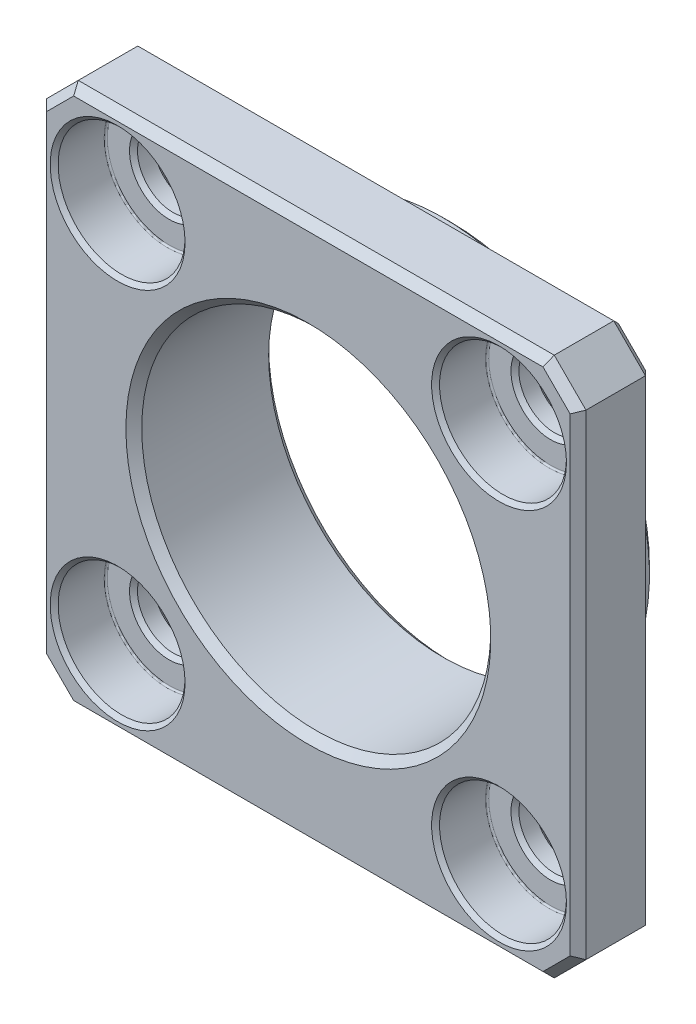
from build123d import *

# Parameters (mm, degrees)
BK_FLANGE_SKETCH_W         = 34
BK_FLANGE_SKETCH_H         = 34
BK_FLANGE_BODY_DEPTH       = 4.75
BK_FLANGE_RADIUS_SKETCH_R  = 13
BK_FLANGE_RADIUS_DEPTH     = 4.25
BK_FLANGE_HOLE_DEPTH       = 26.670995306
BK_FLANGE_HOLE_DEPTH_BACK  = 26.670995306
BK_FLANGE_H_R              = 11
BK_FLANGE_HOLES_AT_2_COUNT = 2
BK_FLANGE_HOLES_AT_2_PITCH = 24.04163056
BK_FLANGE_HOLES_AT_3_COUNT = 2
BK_FLANGE_HOLES_AT_3_PITCH = 34
BK_FLANGE_HOLES_AT_4_COUNT = 2
BK_FLANGE_HOLES_AT_4_PITCH = 24.04163056
BK_CORNER_CHAMFER_SIZE     = 2
PRODUCTION_FILLET_R        = 0.1
AESTHETIC_CHAMFER_SIZE     = 0.5


with BuildPart() as part:
    # BK Flange Sketch → BK Flange Body (new body)
    with BuildSketch(Plane.XY):
        Rectangle(BK_FLANGE_SKETCH_W, BK_FLANGE_SKETCH_H)
    extrude(amount=BK_FLANGE_BODY_DEPTH)

    # BK Flange Radius Sketch → BK Flange Radius (add)
    with BuildSketch(Plane(origin=(0, 0, 0), x_dir=(-1, 0, 0), z_dir=(0, 0, -1))):
        Circle(BK_FLANGE_RADIUS_SKETCH_R)
    extrude(amount=BK_FLANGE_RADIUS_DEPTH)

    # BK Flange H → BK Flange Hole (cut, two sides: drawn at the far end of the back side and taken through both)
    with BuildSketch(Plane(origin=(0, 0, -4.25), x_dir=(-1, 0, 0), z_dir=(0, 0, -1)).offset(-BK_FLANGE_HOLE_DEPTH_BACK)):
        Circle(BK_FLANGE_H_R)
    extrude(amount=BK_FLANGE_HOLE_DEPTH + BK_FLANGE_HOLE_DEPTH_BACK, mode=Mode.SUBTRACT)

    # Sketch2 → BK Flange Holes (revolve, cut)
    with BuildSketch(Plane(origin=(-12.02081528, 12.02081528, 4.75), x_dir=(0, -1, 0), z_dir=(1, 0, 0))):
        Polygon((0, 0), (0, 4.75), (2.5, 4.75), (2.25, 4.5), (2.25, 3.5), (2.5, 3.25), (4, 3.25), (4, 0.25), (4.25, 0), align=None)
    bk_flange_holes = revolve(axis=Axis((-12.02081528, 12.02081528, 11.1), (0, 0, -1)), mode=Mode.SUBTRACT)

    # BK Flange Holes at 2: BK Flange Holes ×2
    with Locations(*[(i * BK_FLANGE_HOLES_AT_2_PITCH, 0, 0) for i in range(1, BK_FLANGE_HOLES_AT_2_COUNT)]):
        add(bk_flange_holes, mode=Mode.SUBTRACT)

    # BK Flange Holes at 3: BK Flange Holes ×2
    with Locations(*[Vector(0.7071067811865476, -0.7071067811865476, 0) * (i * BK_FLANGE_HOLES_AT_3_PITCH) for i in range(1, BK_FLANGE_HOLES_AT_3_COUNT)]):
        add(bk_flange_holes, mode=Mode.SUBTRACT)

    # BK Flange Holes at 4: BK Flange Holes ×2
    with Locations(*[(0, -i * BK_FLANGE_HOLES_AT_4_PITCH, 0) for i in range(1, BK_FLANGE_HOLES_AT_4_COUNT)]):
        add(bk_flange_holes, mode=Mode.SUBTRACT)

    # BK Corner Chamfer
    bk_corner_chamfer_edges = [part.edges().sort_by_distance(p)[0] for p in [
        (17, -17, 2.375),
        (-17, -17, 2.375),
        (-17, 17, 2.375),
        (17, 17, 2.375),
    ]]
    chamfer(bk_corner_chamfer_edges, length=BK_CORNER_CHAMFER_SIZE)

    # Production Fillet
    production_fillet_edges = [part.edges().sort_by_distance(p)[0] for p in [
        (13, 0, 0),
        (-12.02081528, -8.02081528, 1.5),
        (12.02081528, -8.02081528, 1.5),
        (12.02081528, 16.02081528, 1.5),
        (-12.02081528, 16.02081528, 1.5),
    ]]
    fillet(production_fillet_edges, radius=PRODUCTION_FILLET_R)

    # Aesthetic Chamfer
    aesthetic_chamfer_edges = [part.edges().sort_by_distance(p)[0] for p in [
        (13, 0, -4.25),
        (11, 0, -4.25),
        (11, 0, 4.75),
        (0, -17, 0),
        (0, -17, 4.75),
        (17, 0, 0),
        (-17, 0, 0),
        (0, 17, 0),
        (-16, 16, 0),
        (16, 16, 0),
        (16, -16, 0),
        (-16, -16, 0),
        (-17, 0, 4.75),
        (17, 0, 4.75),
        (0, 17, 4.75),
        (-16, 16, 4.75),
        (16, 16, 4.75),
        (16, -16, 4.75),
        (-16, -16, 4.75),
    ]]
    chamfer(aesthetic_chamfer_edges, length=AESTHETIC_CHAMFER_SIZE)


solid = part.part
